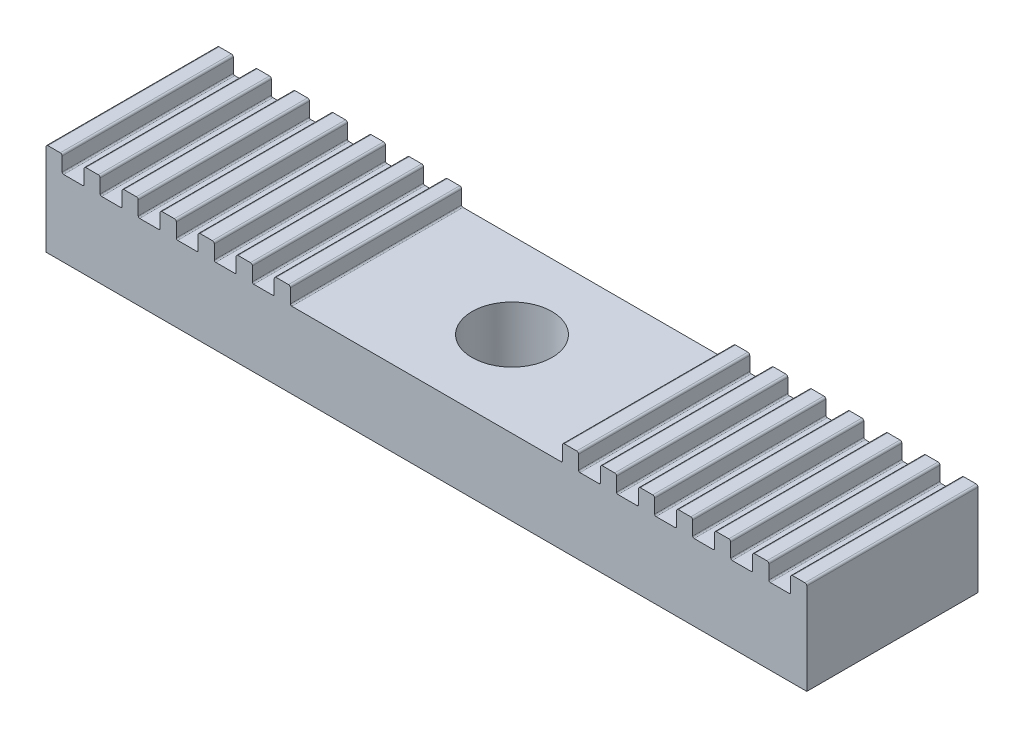
from build123d import *

# Parameters (mm, degrees)
BASES_W                                = 40
BASES_H                                = 9
BASE_DEPTH                             = 4
TOOTHPROFILENESTWALL_REACH             = 22.887
TOOTHPROFILENESTWALL_DIRECTION_2_REACH = 22.887
TPNWLP_COUNT                           = 7
TPNWLP_PITCH                           = 2
TPFILLETCUTS_W                         = 0.075
TPFILLETCUTS_H                         = 0.075
TPFILLETCUT_DEPTH                      = 22.148655395
TPNWSETHM_COPY_1_REACH                 = 22.887
TPNWSETHM_COPY_2_REACH                 = 22.887
TPNWSETHM_COPY_3_REACH                 = 22.887
TPNWSETHM_COPY_4_REACH                 = 22.887
TPNWSETHM_COPY_5_REACH                 = 22.887
TPNWSETHM_COPY_6_REACH                 = 22.887
TPNWSETHM_COPY_7_REACH                 = 22.887
TPNWSETHM_COPY_8_REACH                 = 22.887
TPNWSETHM_COPY_9_REACH                 = 22.887
TPNWSETHM_COPY_10_REACH                = 22.887
TPNWSETHM_COPY_11_REACH                = 22.887
TPNWSETHM_COPY_12_REACH                = 22.887
M4_CLEARANCE_HOLE1_D                   = 4.2
M4_CLEARANCE_HOLE1_CSINK_D             = 4.5
M4_CLEARANCE_HOLE1_CSINK_ANGLE         = 90


with BuildPart() as part:
    # BaseS → Base (new body)
    with BuildSketch(Plane(origin=(0, 0, 0), x_dir=(1, 0, 0), z_dir=(0, 1, 0))):
        Rectangle(BASES_W, BASES_H)
    extrude(amount=BASE_DEPTH)

    # ToothProfileNestWall: up to this face of the body (flat: up to its plane)
    toothprofilenestwall_end = Plane(part.part.faces().sort_by_distance((0, 2, 4.5))[0])
    # ToothProfileNestWallS → ToothProfileNestWall (add, up to the picked face)
    with BuildSketch(Plane.XY, mode=Mode.PRIVATE) as toothprofilenestwall_sk1:
        with BuildLine():
            Line((-19.075, 4), (-20.075, 4))
            ThreePointArc((-20.075, 4), (-20.021966991, 4.021966991), (-20, 4.075))
            Line((-20, 4.075), (-20, 4.8))
            ThreePointArc((-20, 4.8), (-19.970710678, 4.870710678), (-19.9, 4.9))
            Line((-19.9, 4.9), (-19.25, 4.9))
            ThreePointArc((-19.25, 4.9), (-19.179289322, 4.870710678), (-19.15, 4.8))
            Line((-19.15, 4.8), (-19.15, 4.075))
            ThreePointArc((-19.15, 4.075), (-19.128033009, 4.021966991), (-19.075, 4))
        make_face()
    toothprofilenestwall_tool1 = split(extrude(toothprofilenestwall_sk1.sketch, amount=TOOTHPROFILENESTWALL_REACH, mode=Mode.PRIVATE), bisect_by=toothprofilenestwall_end, keep=Keep.BOTH, mode=Mode.PRIVATE)
    toothprofilenestwall = toothprofilenestwall_tool1.solids().sort_by(Axis((-19.575, 4.446224, 0), (0, 0, 1)))[0]
    add(toothprofilenestwall)

    # ToothProfileNestWall direction 2: up to this face of the body (flat: up to its plane)
    toothprofilenestwall_direction_2_end = Plane(part.part.faces().sort_by_distance((0, 2, -4.5))[0])
    # ToothProfileNestWallS → ToothProfileNestWall direction 2 (add, up to the picked face)
    with BuildSketch(Plane.XY, mode=Mode.PRIVATE) as toothprofilenestwall_direction_2_sk1:
        with BuildLine():
            Line((-19.075, 4), (-20.075, 4))
            ThreePointArc((-20.075, 4), (-20.021966991, 4.021966991), (-20, 4.075))
            Line((-20, 4.075), (-20, 4.8))
            ThreePointArc((-20, 4.8), (-19.970710678, 4.870710678), (-19.9, 4.9))
            Line((-19.9, 4.9), (-19.25, 4.9))
            ThreePointArc((-19.25, 4.9), (-19.179289322, 4.870710678), (-19.15, 4.8))
            Line((-19.15, 4.8), (-19.15, 4.075))
            ThreePointArc((-19.15, 4.075), (-19.128033009, 4.021966991), (-19.075, 4))
        make_face()
    toothprofilenestwall_direction_2_tool1 = split(extrude(toothprofilenestwall_direction_2_sk1.sketch, amount=-TOOTHPROFILENESTWALL_DIRECTION_2_REACH, mode=Mode.PRIVATE), bisect_by=toothprofilenestwall_direction_2_end, keep=Keep.BOTH, mode=Mode.PRIVATE)
    toothprofilenestwall_direction_2 = toothprofilenestwall_direction_2_tool1.solids().sort_by(Axis((-19.575, 4.446224, 0), (0, 0, -1)))[0]
    add(toothprofilenestwall_direction_2)

    # TPNWLP: ToothProfileNestWall, ToothProfileNestWall direction 2 ×7
    with Locations(*[(i * TPNWLP_PITCH, 0, 0) for i in range(1, TPNWLP_COUNT)]):
        add(toothprofilenestwall)
        add(toothprofilenestwall_direction_2)

    # TPFilletCutS → TPFilletCut (cut, symmetric)
    with BuildSketch(Plane.XY):
        with Locations((-20.0375, 4.0375)):
            Rectangle(TPFILLETCUTS_W, TPFILLETCUTS_H)
    tpfilletcut = extrude(amount=TPFILLETCUT_DEPTH, both=True, mode=Mode.SUBTRACT)

    # TPNWSetHM: ToothProfileNestWall, ToothProfileNestWall direction 2, TPFilletCut across plane
    add(toothprofilenestwall.mirror(Plane(origin=(0, 0, 0), x_dir=(0, 0, 1), z_dir=(1, 0, 0))))
    add(toothprofilenestwall_direction_2.mirror(Plane(origin=(0, 0, 0), x_dir=(0, 0, 1), z_dir=(1, 0, 0))))
    add(tpfilletcut.mirror(Plane(origin=(0, 0, 0), x_dir=(0, 0, 1), z_dir=(1, 0, 0))), mode=Mode.SUBTRACT)

    # TPNWSetHM copy 1: up to this face of the body (flat: up to its plane)
    tpnwsethm_copy_1_end = Plane(part.part.faces().sort_by_distance((-2, 2, 4.5))[0])
    # TPNWSetHM copy 1 sketch → TPNWSetHM copy 1 (add, up to the picked face)
    with BuildSketch(Plane(origin=(-2, 0, 0), x_dir=(-1, 0, 0), z_dir=(0, 0, 1)), mode=Mode.PRIVATE) as tpnwsethm_copy_1_sk1:
        with BuildLine():
            Line((-19.075, -4), (-20.075, -4))
            ThreePointArc((-20.075, -4), (-20.021966991, -4.021966991), (-20, -4.075))
            Line((-20, -4.075), (-20, -4.8))
            ThreePointArc((-20, -4.8), (-19.970710678, -4.870710678), (-19.9, -4.9))
            Line((-19.9, -4.9), (-19.25, -4.9))
            ThreePointArc((-19.25, -4.9), (-19.179289322, -4.870710678), (-19.15, -4.8))
            Line((-19.15, -4.8), (-19.15, -4.075))
            ThreePointArc((-19.15, -4.075), (-19.128033009, -4.021966991), (-19.075, -4))
        make_face()
    tpnwsethm_copy_1_tool1 = split(extrude(tpnwsethm_copy_1_sk1.sketch, amount=TPNWSETHM_COPY_1_REACH, mode=Mode.PRIVATE), bisect_by=tpnwsethm_copy_1_end, keep=Keep.BOTH, mode=Mode.PRIVATE)
    add(tpnwsethm_copy_1_tool1.solids().sort_by(Axis((17.575, 4.446224, 0), (0, 0, 1)))[0])

    # TPNWSetHM copy 2: up to this face of the body (flat: up to its plane)
    tpnwsethm_copy_2_end = Plane(part.part.faces().sort_by_distance((-4, 2, 4.5))[0])
    # TPNWSetHM copy 2 sketch → TPNWSetHM copy 2 (add, up to the picked face)
    with BuildSketch(Plane(origin=(-4, 0, 0), x_dir=(-1, 0, 0), z_dir=(0, 0, 1)), mode=Mode.PRIVATE) as tpnwsethm_copy_2_sk1:
        with BuildLine():
            Line((-19.075, -4), (-20.075, -4))
            ThreePointArc((-20.075, -4), (-20.021966991, -4.021966991), (-20, -4.075))
            Line((-20, -4.075), (-20, -4.8))
            ThreePointArc((-20, -4.8), (-19.970710678, -4.870710678), (-19.9, -4.9))
            Line((-19.9, -4.9), (-19.25, -4.9))
            ThreePointArc((-19.25, -4.9), (-19.179289322, -4.870710678), (-19.15, -4.8))
            Line((-19.15, -4.8), (-19.15, -4.075))
            ThreePointArc((-19.15, -4.075), (-19.128033009, -4.021966991), (-19.075, -4))
        make_face()
    tpnwsethm_copy_2_tool1 = split(extrude(tpnwsethm_copy_2_sk1.sketch, amount=TPNWSETHM_COPY_2_REACH, mode=Mode.PRIVATE), bisect_by=tpnwsethm_copy_2_end, keep=Keep.BOTH, mode=Mode.PRIVATE)
    add(tpnwsethm_copy_2_tool1.solids().sort_by(Axis((15.575, 4.446224, 0), (0, 0, 1)))[0])

    # TPNWSetHM copy 3: up to this face of the body (flat: up to its plane)
    tpnwsethm_copy_3_end = Plane(part.part.faces().sort_by_distance((-6, 2, 4.5))[0])
    # TPNWSetHM copy 3 sketch → TPNWSetHM copy 3 (add, up to the picked face)
    with BuildSketch(Plane(origin=(-6, 0, 0), x_dir=(-1, 0, 0), z_dir=(0, 0, 1)), mode=Mode.PRIVATE) as tpnwsethm_copy_3_sk1:
        with BuildLine():
            Line((-19.075, -4), (-20.075, -4))
            ThreePointArc((-20.075, -4), (-20.021966991, -4.021966991), (-20, -4.075))
            Line((-20, -4.075), (-20, -4.8))
            ThreePointArc((-20, -4.8), (-19.970710678, -4.870710678), (-19.9, -4.9))
            Line((-19.9, -4.9), (-19.25, -4.9))
            ThreePointArc((-19.25, -4.9), (-19.179289322, -4.870710678), (-19.15, -4.8))
            Line((-19.15, -4.8), (-19.15, -4.075))
            ThreePointArc((-19.15, -4.075), (-19.128033009, -4.021966991), (-19.075, -4))
        make_face()
    tpnwsethm_copy_3_tool1 = split(extrude(tpnwsethm_copy_3_sk1.sketch, amount=TPNWSETHM_COPY_3_REACH, mode=Mode.PRIVATE), bisect_by=tpnwsethm_copy_3_end, keep=Keep.BOTH, mode=Mode.PRIVATE)
    add(tpnwsethm_copy_3_tool1.solids().sort_by(Axis((13.575, 4.446224, 0), (0, 0, 1)))[0])

    # TPNWSetHM copy 4: up to this face of the body (flat: up to its plane)
    tpnwsethm_copy_4_end = Plane(part.part.faces().sort_by_distance((-8, 2, 4.5))[0])
    # TPNWSetHM copy 4 sketch → TPNWSetHM copy 4 (add, up to the picked face)
    with BuildSketch(Plane(origin=(-8, 0, 0), x_dir=(-1, 0, 0), z_dir=(0, 0, 1)), mode=Mode.PRIVATE) as tpnwsethm_copy_4_sk1:
        with BuildLine():
            Line((-19.075, -4), (-20.075, -4))
            ThreePointArc((-20.075, -4), (-20.021966991, -4.021966991), (-20, -4.075))
            Line((-20, -4.075), (-20, -4.8))
            ThreePointArc((-20, -4.8), (-19.970710678, -4.870710678), (-19.9, -4.9))
            Line((-19.9, -4.9), (-19.25, -4.9))
            ThreePointArc((-19.25, -4.9), (-19.179289322, -4.870710678), (-19.15, -4.8))
            Line((-19.15, -4.8), (-19.15, -4.075))
            ThreePointArc((-19.15, -4.075), (-19.128033009, -4.021966991), (-19.075, -4))
        make_face()
    tpnwsethm_copy_4_tool1 = split(extrude(tpnwsethm_copy_4_sk1.sketch, amount=TPNWSETHM_COPY_4_REACH, mode=Mode.PRIVATE), bisect_by=tpnwsethm_copy_4_end, keep=Keep.BOTH, mode=Mode.PRIVATE)
    add(tpnwsethm_copy_4_tool1.solids().sort_by(Axis((11.575, 4.446224, 0), (0, 0, 1)))[0])

    # TPNWSetHM copy 5: up to this face of the body (flat: up to its plane)
    tpnwsethm_copy_5_end = Plane(part.part.faces().sort_by_distance((-10, 2, 4.5))[0])
    # TPNWSetHM copy 5 sketch → TPNWSetHM copy 5 (add, up to the picked face)
    with BuildSketch(Plane(origin=(-10, 0, 0), x_dir=(-1, 0, 0), z_dir=(0, 0, 1)), mode=Mode.PRIVATE) as tpnwsethm_copy_5_sk1:
        with BuildLine():
            Line((-19.075, -4), (-20.075, -4))
            ThreePointArc((-20.075, -4), (-20.021966991, -4.021966991), (-20, -4.075))
            Line((-20, -4.075), (-20, -4.8))
            ThreePointArc((-20, -4.8), (-19.970710678, -4.870710678), (-19.9, -4.9))
            Line((-19.9, -4.9), (-19.25, -4.9))
            ThreePointArc((-19.25, -4.9), (-19.179289322, -4.870710678), (-19.15, -4.8))
            Line((-19.15, -4.8), (-19.15, -4.075))
            ThreePointArc((-19.15, -4.075), (-19.128033009, -4.021966991), (-19.075, -4))
        make_face()
    tpnwsethm_copy_5_tool1 = split(extrude(tpnwsethm_copy_5_sk1.sketch, amount=TPNWSETHM_COPY_5_REACH, mode=Mode.PRIVATE), bisect_by=tpnwsethm_copy_5_end, keep=Keep.BOTH, mode=Mode.PRIVATE)
    add(tpnwsethm_copy_5_tool1.solids().sort_by(Axis((9.575, 4.446224, 0), (0, 0, 1)))[0])

    # TPNWSetHM copy 6: up to this face of the body (flat: up to its plane)
    tpnwsethm_copy_6_end = Plane(part.part.faces().sort_by_distance((-12, 2, 4.5))[0])
    # TPNWSetHM copy 6 sketch → TPNWSetHM copy 6 (add, up to the picked face)
    with BuildSketch(Plane(origin=(-12, 0, 0), x_dir=(-1, 0, 0), z_dir=(0, 0, 1)), mode=Mode.PRIVATE) as tpnwsethm_copy_6_sk1:
        with BuildLine():
            Line((-19.075, -4), (-20.075, -4))
            ThreePointArc((-20.075, -4), (-20.021966991, -4.021966991), (-20, -4.075))
            Line((-20, -4.075), (-20, -4.8))
            ThreePointArc((-20, -4.8), (-19.970710678, -4.870710678), (-19.9, -4.9))
            Line((-19.9, -4.9), (-19.25, -4.9))
            ThreePointArc((-19.25, -4.9), (-19.179289322, -4.870710678), (-19.15, -4.8))
            Line((-19.15, -4.8), (-19.15, -4.075))
            ThreePointArc((-19.15, -4.075), (-19.128033009, -4.021966991), (-19.075, -4))
        make_face()
    tpnwsethm_copy_6_tool1 = split(extrude(tpnwsethm_copy_6_sk1.sketch, amount=TPNWSETHM_COPY_6_REACH, mode=Mode.PRIVATE), bisect_by=tpnwsethm_copy_6_end, keep=Keep.BOTH, mode=Mode.PRIVATE)
    add(tpnwsethm_copy_6_tool1.solids().sort_by(Axis((7.575, 4.446224, 0), (0, 0, 1)))[0])

    # TPNWSetHM copy 7: up to this face of the body (flat: up to its plane)
    tpnwsethm_copy_7_end = Plane(part.part.faces().sort_by_distance((-2, 2, -4.5))[0])
    # TPNWSetHM copy 7 sketch → TPNWSetHM copy 7 (add, up to the picked face)
    with BuildSketch(Plane(origin=(-2, 0, 0), x_dir=(-1, 0, 0), z_dir=(0, 0, 1)), mode=Mode.PRIVATE) as tpnwsethm_copy_7_sk1:
        with BuildLine():
            Line((-19.075, -4), (-20.075, -4))
            ThreePointArc((-20.075, -4), (-20.021966991, -4.021966991), (-20, -4.075))
            Line((-20, -4.075), (-20, -4.8))
            ThreePointArc((-20, -4.8), (-19.970710678, -4.870710678), (-19.9, -4.9))
            Line((-19.9, -4.9), (-19.25, -4.9))
            ThreePointArc((-19.25, -4.9), (-19.179289322, -4.870710678), (-19.15, -4.8))
            Line((-19.15, -4.8), (-19.15, -4.075))
            ThreePointArc((-19.15, -4.075), (-19.128033009, -4.021966991), (-19.075, -4))
        make_face()
    tpnwsethm_copy_7_tool1 = split(extrude(tpnwsethm_copy_7_sk1.sketch, amount=-TPNWSETHM_COPY_7_REACH, mode=Mode.PRIVATE), bisect_by=tpnwsethm_copy_7_end, keep=Keep.BOTH, mode=Mode.PRIVATE)
    add(tpnwsethm_copy_7_tool1.solids().sort_by(Axis((17.575, 4.446224, 0), (0, 0, -1)))[0])

    # TPNWSetHM copy 8: up to this face of the body (flat: up to its plane)
    tpnwsethm_copy_8_end = Plane(part.part.faces().sort_by_distance((-4, 2, -4.5))[0])
    # TPNWSetHM copy 8 sketch → TPNWSetHM copy 8 (add, up to the picked face)
    with BuildSketch(Plane(origin=(-4, 0, 0), x_dir=(-1, 0, 0), z_dir=(0, 0, 1)), mode=Mode.PRIVATE) as tpnwsethm_copy_8_sk1:
        with BuildLine():
            Line((-19.075, -4), (-20.075, -4))
            ThreePointArc((-20.075, -4), (-20.021966991, -4.021966991), (-20, -4.075))
            Line((-20, -4.075), (-20, -4.8))
            ThreePointArc((-20, -4.8), (-19.970710678, -4.870710678), (-19.9, -4.9))
            Line((-19.9, -4.9), (-19.25, -4.9))
            ThreePointArc((-19.25, -4.9), (-19.179289322, -4.870710678), (-19.15, -4.8))
            Line((-19.15, -4.8), (-19.15, -4.075))
            ThreePointArc((-19.15, -4.075), (-19.128033009, -4.021966991), (-19.075, -4))
        make_face()
    tpnwsethm_copy_8_tool1 = split(extrude(tpnwsethm_copy_8_sk1.sketch, amount=-TPNWSETHM_COPY_8_REACH, mode=Mode.PRIVATE), bisect_by=tpnwsethm_copy_8_end, keep=Keep.BOTH, mode=Mode.PRIVATE)
    add(tpnwsethm_copy_8_tool1.solids().sort_by(Axis((15.575, 4.446224, 0), (0, 0, -1)))[0])

    # TPNWSetHM copy 9: up to this face of the body (flat: up to its plane)
    tpnwsethm_copy_9_end = Plane(part.part.faces().sort_by_distance((-6, 2, -4.5))[0])
    # TPNWSetHM copy 9 sketch → TPNWSetHM copy 9 (add, up to the picked face)
    with BuildSketch(Plane(origin=(-6, 0, 0), x_dir=(-1, 0, 0), z_dir=(0, 0, 1)), mode=Mode.PRIVATE) as tpnwsethm_copy_9_sk1:
        with BuildLine():
            Line((-19.075, -4), (-20.075, -4))
            ThreePointArc((-20.075, -4), (-20.021966991, -4.021966991), (-20, -4.075))
            Line((-20, -4.075), (-20, -4.8))
            ThreePointArc((-20, -4.8), (-19.970710678, -4.870710678), (-19.9, -4.9))
            Line((-19.9, -4.9), (-19.25, -4.9))
            ThreePointArc((-19.25, -4.9), (-19.179289322, -4.870710678), (-19.15, -4.8))
            Line((-19.15, -4.8), (-19.15, -4.075))
            ThreePointArc((-19.15, -4.075), (-19.128033009, -4.021966991), (-19.075, -4))
        make_face()
    tpnwsethm_copy_9_tool1 = split(extrude(tpnwsethm_copy_9_sk1.sketch, amount=-TPNWSETHM_COPY_9_REACH, mode=Mode.PRIVATE), bisect_by=tpnwsethm_copy_9_end, keep=Keep.BOTH, mode=Mode.PRIVATE)
    add(tpnwsethm_copy_9_tool1.solids().sort_by(Axis((13.575, 4.446224, 0), (0, 0, -1)))[0])

    # TPNWSetHM copy 10: up to this face of the body (flat: up to its plane)
    tpnwsethm_copy_10_end = Plane(part.part.faces().sort_by_distance((-8, 2, -4.5))[0])
    # TPNWSetHM copy 10 sketch → TPNWSetHM copy 10 (add, up to the picked face)
    with BuildSketch(Plane(origin=(-8, 0, 0), x_dir=(-1, 0, 0), z_dir=(0, 0, 1)), mode=Mode.PRIVATE) as tpnwsethm_copy_10_sk1:
        with BuildLine():
            Line((-19.075, -4), (-20.075, -4))
            ThreePointArc((-20.075, -4), (-20.021966991, -4.021966991), (-20, -4.075))
            Line((-20, -4.075), (-20, -4.8))
            ThreePointArc((-20, -4.8), (-19.970710678, -4.870710678), (-19.9, -4.9))
            Line((-19.9, -4.9), (-19.25, -4.9))
            ThreePointArc((-19.25, -4.9), (-19.179289322, -4.870710678), (-19.15, -4.8))
            Line((-19.15, -4.8), (-19.15, -4.075))
            ThreePointArc((-19.15, -4.075), (-19.128033009, -4.021966991), (-19.075, -4))
        make_face()
    tpnwsethm_copy_10_tool1 = split(extrude(tpnwsethm_copy_10_sk1.sketch, amount=-TPNWSETHM_COPY_10_REACH, mode=Mode.PRIVATE), bisect_by=tpnwsethm_copy_10_end, keep=Keep.BOTH, mode=Mode.PRIVATE)
    add(tpnwsethm_copy_10_tool1.solids().sort_by(Axis((11.575, 4.446224, 0), (0, 0, -1)))[0])

    # TPNWSetHM copy 11: up to this face of the body (flat: up to its plane)
    tpnwsethm_copy_11_end = Plane(part.part.faces().sort_by_distance((-10, 2, -4.5))[0])
    # TPNWSetHM copy 11 sketch → TPNWSetHM copy 11 (add, up to the picked face)
    with BuildSketch(Plane(origin=(-10, 0, 0), x_dir=(-1, 0, 0), z_dir=(0, 0, 1)), mode=Mode.PRIVATE) as tpnwsethm_copy_11_sk1:
        with BuildLine():
            Line((-19.075, -4), (-20.075, -4))
            ThreePointArc((-20.075, -4), (-20.021966991, -4.021966991), (-20, -4.075))
            Line((-20, -4.075), (-20, -4.8))
            ThreePointArc((-20, -4.8), (-19.970710678, -4.870710678), (-19.9, -4.9))
            Line((-19.9, -4.9), (-19.25, -4.9))
            ThreePointArc((-19.25, -4.9), (-19.179289322, -4.870710678), (-19.15, -4.8))
            Line((-19.15, -4.8), (-19.15, -4.075))
            ThreePointArc((-19.15, -4.075), (-19.128033009, -4.021966991), (-19.075, -4))
        make_face()
    tpnwsethm_copy_11_tool1 = split(extrude(tpnwsethm_copy_11_sk1.sketch, amount=-TPNWSETHM_COPY_11_REACH, mode=Mode.PRIVATE), bisect_by=tpnwsethm_copy_11_end, keep=Keep.BOTH, mode=Mode.PRIVATE)
    add(tpnwsethm_copy_11_tool1.solids().sort_by(Axis((9.575, 4.446224, 0), (0, 0, -1)))[0])

    # TPNWSetHM copy 12: up to this face of the body (flat: up to its plane)
    tpnwsethm_copy_12_end = Plane(part.part.faces().sort_by_distance((-12, 2, -4.5))[0])
    # TPNWSetHM copy 12 sketch → TPNWSetHM copy 12 (add, up to the picked face)
    with BuildSketch(Plane(origin=(-12, 0, 0), x_dir=(-1, 0, 0), z_dir=(0, 0, 1)), mode=Mode.PRIVATE) as tpnwsethm_copy_12_sk1:
        with BuildLine():
            Line((-19.075, -4), (-20.075, -4))
            ThreePointArc((-20.075, -4), (-20.021966991, -4.021966991), (-20, -4.075))
            Line((-20, -4.075), (-20, -4.8))
            ThreePointArc((-20, -4.8), (-19.970710678, -4.870710678), (-19.9, -4.9))
            Line((-19.9, -4.9), (-19.25, -4.9))
            ThreePointArc((-19.25, -4.9), (-19.179289322, -4.870710678), (-19.15, -4.8))
            Line((-19.15, -4.8), (-19.15, -4.075))
            ThreePointArc((-19.15, -4.075), (-19.128033009, -4.021966991), (-19.075, -4))
        make_face()
    tpnwsethm_copy_12_tool1 = split(extrude(tpnwsethm_copy_12_sk1.sketch, amount=-TPNWSETHM_COPY_12_REACH, mode=Mode.PRIVATE), bisect_by=tpnwsethm_copy_12_end, keep=Keep.BOTH, mode=Mode.PRIVATE)
    add(tpnwsethm_copy_12_tool1.solids().sort_by(Axis((7.575, 4.446224, 0), (0, 0, -1)))[0])

    # M4 Clearance Hole1 (through all)
    with Locations(Plane(origin=(0, 0, 0), x_dir=(-1, 0, 0), z_dir=(0, -1, 0))):
        with Locations((0, 0)):
            CounterSinkHole(M4_CLEARANCE_HOLE1_D / 2, M4_CLEARANCE_HOLE1_CSINK_D / 2, counter_sink_angle=M4_CLEARANCE_HOLE1_CSINK_ANGLE)


solid = part.part
